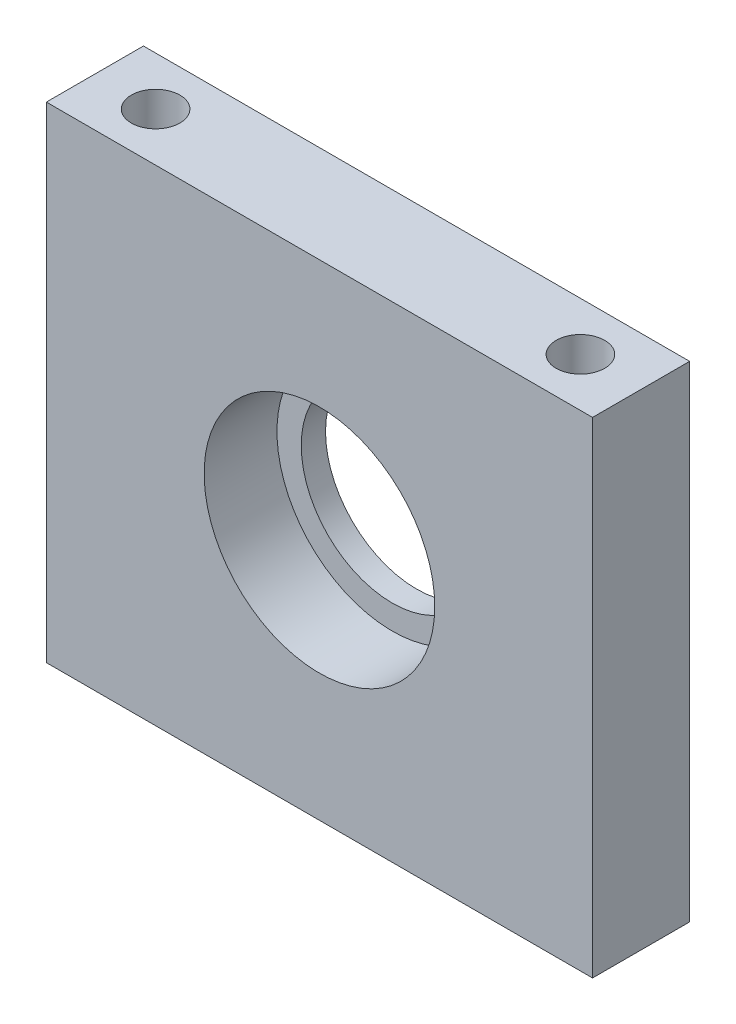
from build123d import *

# Parameters (mm, degrees)
ESQUISSE1_W             = 45
ESQUISSE1_H             = 40
BOSS_EXTRU_1_DEPTH      = 8
ESQUISSE2_R             = 7.5
ENL_V_MAT_EXTRU_1_DEPTH = 32.148836254
ESQUISSE3_R             = 9.5
ENL_V_MAT_EXTRU_2_DEPTH = 6
ESQUISSE4_R             = 2
ENL_V_MAT_EXTRU_3_DEPTH = 47.585942086


with BuildPart() as part:
    # Esquisse1 → Boss.-Extru.1 (new body)
    with BuildSketch(Plane.XY):
        Rectangle(ESQUISSE1_W, ESQUISSE1_H)
    extrude(amount=BOSS_EXTRU_1_DEPTH)

    # Esquisse2 → Enlèv. mat.-Extru.1 (cut, through all)
    with BuildSketch(Plane.XY.offset(8)):
        Circle(ESQUISSE2_R)
    extrude(amount=-ENL_V_MAT_EXTRU_1_DEPTH, mode=Mode.SUBTRACT)

    # Esquisse3 → Enlèv. mat.-Extru.2 (cut)
    with BuildSketch(Plane.XY.offset(8)):
        Circle(ESQUISSE3_R)
    extrude(amount=-ENL_V_MAT_EXTRU_2_DEPTH, mode=Mode.SUBTRACT)

    # Esquisse4 → Enlèv. mat.-Extru.3 (cut, through all)
    with BuildSketch(Plane(origin=(0, 20, 0), x_dir=(1, 0, 0), z_dir=(0, 1, 0))):
        with Locations(Location((-17.5, -4, 0), (0, 0, 270))):
            Circle(ESQUISSE4_R)
        with Locations(Location((17.5, -4, 0), (0, 0, 270))):
            Circle(ESQUISSE4_R)
    extrude(amount=-ENL_V_MAT_EXTRU_3_DEPTH, mode=Mode.SUBTRACT)


solid = part.part
